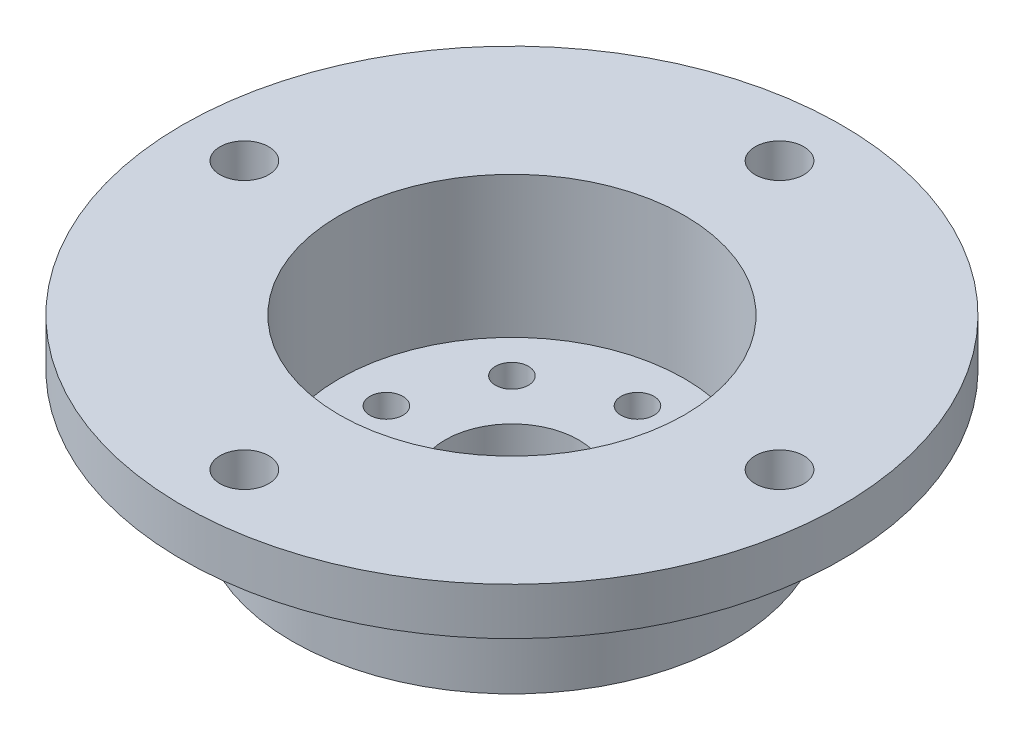
from build123d import *

# Parameters (mm, degrees)
ESQUISSE4_R             = 1.05
ENL_V_MAT_EXTRU_1_DEPTH = 32.032241298
ESQUISSE5_R             = 1.55
ENL_V_MAT_EXTRU_2_DEPTH = 31.757112998


with BuildPart() as part:
    # Esquisse3 → Révolution2 (revolve)
    with BuildSketch(Plane.XY):
        Polygon((-21, 23.3897956), (-21, 20.3897956), (-14, 20.3897956), (-14, 12.3897956), (-4.25, 12.3897956), (-4.25, 14.3897956), (-11, 14.3897956), (-11, 23.3897956), align=None)
    revolve(axis=Axis((0, 36.82979074, 0), (0, -1, 0)))

    # Esquisse4 → Enlèv. mat.-Extru.1 (cut, through all)
    with BuildSketch(Plane(origin=(0, 14.3897956, 0), x_dir=(1, 0, 0), z_dir=(0, 1, 0))):
        with Locations(Location((0, 8, 0), (0, 0, 180))):
            Circle(ESQUISSE4_R)
        with Locations(Location((5.656854249, 5.656854249, 0), (0, 0, 180))):
            Circle(ESQUISSE4_R)
        with Locations(Location((8, 0, 0), (0, 0, 180))):
            Circle(ESQUISSE4_R)
        with Locations(Location((5.656854249, -5.656854249, 0), (0, 0, 180))):
            Circle(ESQUISSE4_R)
        with Locations(Location((0, -8, 0), (0, 0, 180))):
            Circle(ESQUISSE4_R)
        with Locations(Location((-5.656854249, -5.656854249, 0), (0, 0, 180))):
            Circle(ESQUISSE4_R)
        with Locations(Location((-8, 0, 0), (0, 0, 180))):
            Circle(ESQUISSE4_R)
        with Locations(Location((-5.656854249, 5.656854249, 0), (0, 0, 180))):
            Circle(ESQUISSE4_R)
    extrude(amount=-ENL_V_MAT_EXTRU_1_DEPTH, mode=Mode.SUBTRACT)

    # Esquisse5 → Enlèv. mat.-Extru.2 (cut, through all)
    with BuildSketch(Plane.XZ.offset(-20.3897956)):
        with Locations((0, 17.05)):
            Circle(ESQUISSE5_R)
        with Locations((17.05, 0)):
            Circle(ESQUISSE5_R)
        with Locations((0, -17.05)):
            Circle(ESQUISSE5_R)
        with Locations((-17.05, 0)):
            Circle(ESQUISSE5_R)
    extrude(amount=-ENL_V_MAT_EXTRU_2_DEPTH, mode=Mode.SUBTRACT)


solid = part.part
